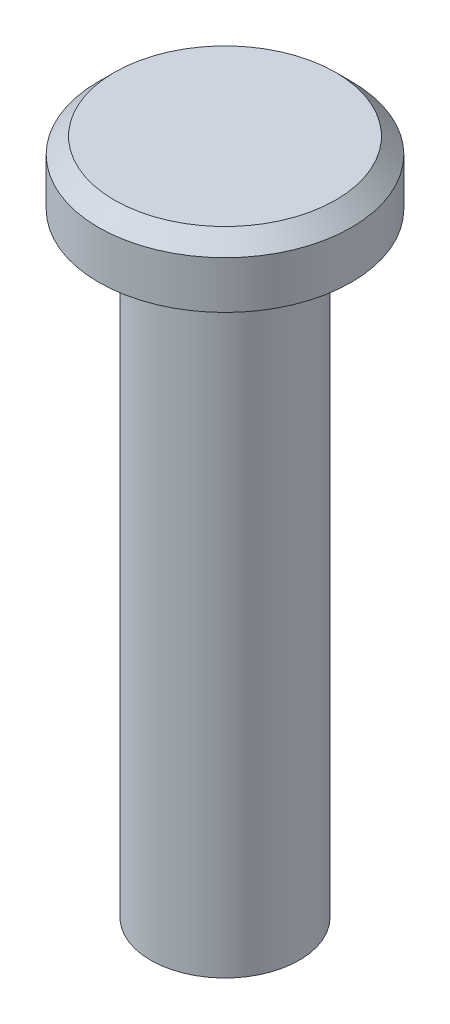
from build123d import *

# Parameters (mm, degrees)
SKETCH1_R           = 2.35
BOSS_EXTRUDE1_DEPTH = 19.4
SKETCH2_R           = 4
BOSS_EXTRUDE2_DEPTH = 2
CHAMFER1_SIZE       = 0.5
SKETCH3_R           = 1.5
CUT_EXTRUDE1_DEPTH  = 4


with BuildPart() as part:
    # Sketch1 → Boss-Extrude1 (new body)
    with BuildSketch(Plane(origin=(0, 0, 0), x_dir=(1, 0, 0), z_dir=(0, 1, 0))):
        with Locations(Location((0, 0, 0), (0, 0, 270))):
            Circle(SKETCH1_R)
    extrude(amount=BOSS_EXTRUDE1_DEPTH)

    # Sketch2 → Boss-Extrude2 (add)
    with BuildSketch(Plane(origin=(0, 19.4, 0), x_dir=(1, 0, 0), z_dir=(0, 1, 0))):
        with Locations(Location((0, 0, 0), (0, 0, 270))):
            Circle(SKETCH2_R)
    extrude(amount=BOSS_EXTRUDE2_DEPTH)

    # Chamfer1
    chamfer1_edges = [part.edges().sort_by_distance(p)[0] for p in [
        (0, 21.4, -4),
    ]]
    chamfer(chamfer1_edges, length=CHAMFER1_SIZE)

    # Sketch3 → Cut-Extrude1 (cut)
    with BuildSketch(Plane.XZ):
        with Locations(Location((0, 0, 0), (0, 0, 270))):
            Circle(SKETCH3_R)
    extrude(amount=-CUT_EXTRUDE1_DEPTH, mode=Mode.SUBTRACT)


solid = part.part
